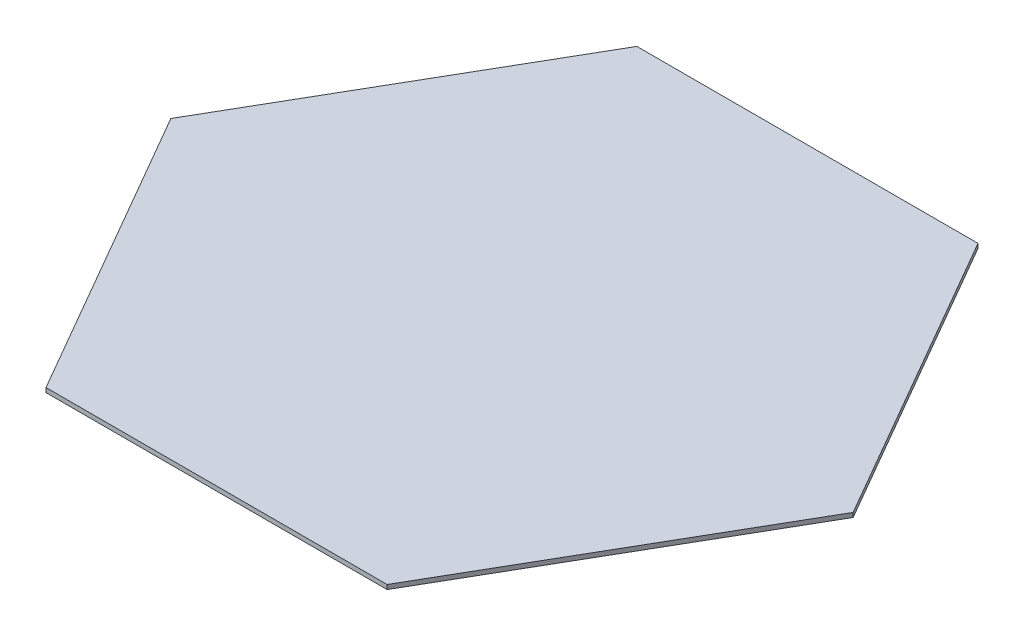
from build123d import *

# Parameters (mm, degrees)
BOSS_EXTRUDE1_DEPTH = 3


with BuildPart() as part:
    # Sketch2 → Boss-Extrude1 (new body)
    with BuildSketch(Plane(origin=(0, 0, 0), x_dir=(1, 0, 0), z_dir=(0, 1, 0))):
        Polygon((230.940107676, 0), (115.470053838, 200), (-115.470053838, 200), (-230.940107676, 0), (-115.470053838, -200), (115.470053838, -200), align=None)
    extrude(amount=BOSS_EXTRUDE1_DEPTH)


solid = part.part
